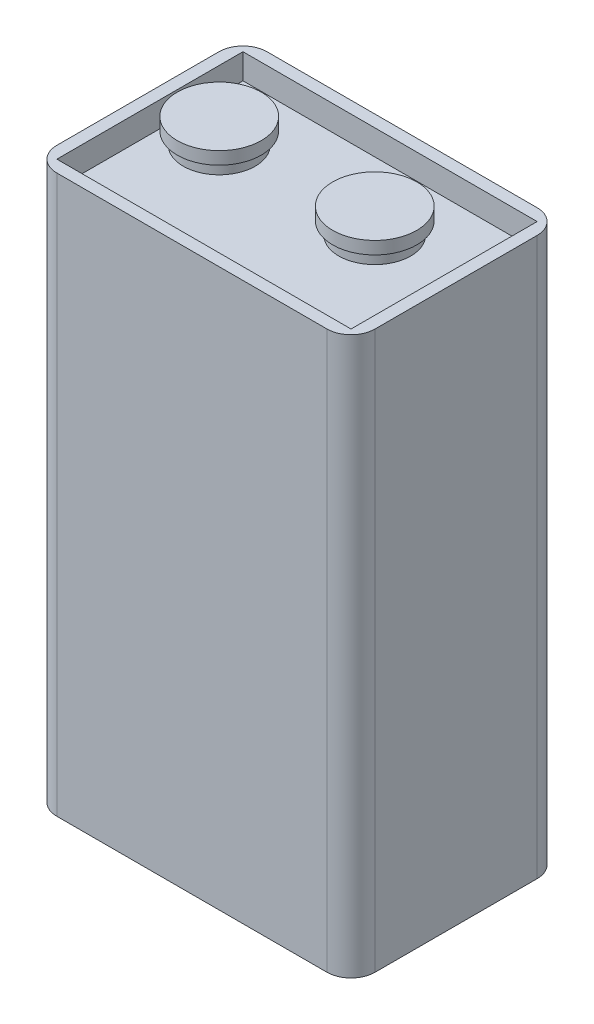
from build123d import *

# Parameters (mm, degrees)
SKETCH2_W           = 26.5
SKETCH2_H           = 17.5
BOSS_EXTRUDE1_DEPTH = 46.4
SKETCH4_R           = 3
BOSS_EXTRUDE5_DEPTH = 1.05
SKETCH5_R           = 3.5
BOSS_EXTRUDE6_DEPTH = 1.05
SKETCH6_R           = 3.5
BOSS_EXTRUDE7_DEPTH = 1.05
SKETCH9_W           = 24.5
SKETCH9_H           = 15.5
CUT_EXTRUDE2_DEPTH  = 2.1
FILLET1_R           = 2
FILLET2_R           = 2
FILLET3_R           = 2
FILLET4_R           = 2


with BuildPart() as part:
    # Sketch2 → Boss-Extrude1 (new body)
    with BuildSketch(Plane(origin=(0, 0, 0), x_dir=(1, 0, 0), z_dir=(0, 1, 0))):
        with Locations((13.25, 8.75)):
            Rectangle(SKETCH2_W, SKETCH2_H)
    extrude(amount=-BOSS_EXTRUDE1_DEPTH)

    # Sketch4 → Boss-Extrude5 (add)
    with BuildSketch(Plane(origin=(0, 0, 0), x_dir=(1, 0, 0), z_dir=(0, 1, 0))):
        with Locations(Location((19.725, 8.75, 0), (0, 0, 90))):
            Circle(SKETCH4_R)
        with Locations(Location((6.775, 8.75, 0), (0, 0, 90))):
            Circle(SKETCH4_R)
    extrude(amount=BOSS_EXTRUDE5_DEPTH)

    # Sketch5 → Boss-Extrude6 (add)
    with BuildSketch(Plane(origin=(0, 1.05, 0), x_dir=(1, 0, 0), z_dir=(0, 1, 0))):
        with Locations(Location((6.775, 8.75, 0), (0, 0, 270))):
            Circle(SKETCH5_R)
    extrude(amount=BOSS_EXTRUDE6_DEPTH)

    # Sketch6 → Boss-Extrude7 (add)
    with BuildSketch(Plane(origin=(0, 1.05, 0), x_dir=(1, 0, 0), z_dir=(0, 1, 0))):
        with Locations(Location((19.725, 8.75, 0), (0, 0, 270))):
            Circle(SKETCH6_R)
    extrude(amount=BOSS_EXTRUDE7_DEPTH)

    # Sketch9 → Cut-Extrude2 (cut)
    with BuildSketch(Plane(origin=(0, 0, 0), x_dir=(1, 0, 0), z_dir=(0, 1, 0))):
        with Locations((13.25, 8.75)):
            Rectangle(SKETCH9_W, SKETCH9_H)
    extrude(amount=-CUT_EXTRUDE2_DEPTH, mode=Mode.SUBTRACT)


with BuildPart() as cut_extrude2_piece_1:
    # of the separate pieces the step leaves, piece 1, a body of its own (cut_extrude2_pieces)
    add(part.part.solids().sort_by_distance((0, 0, 0))[0])

    # Fillet1
    fillet1_edges = [cut_extrude2_piece_1.edges().sort_by_distance(p)[0] for p in [
        (26.5, -23.2, 0),
    ]]
    fillet(fillet1_edges, radius=FILLET1_R)

    # Fillet2
    fillet2_edges = [cut_extrude2_piece_1.edges().sort_by_distance(p)[0] for p in [
        (26.5, -23.2, -17.5),
    ]]
    fillet(fillet2_edges, radius=FILLET2_R)

    # Fillet3
    fillet3_edges = [cut_extrude2_piece_1.edges().sort_by_distance(p)[0] for p in [
        (0, -23.2, -17.5),
    ]]
    fillet(fillet3_edges, radius=FILLET3_R)

    # Fillet4
    fillet4_edges = [cut_extrude2_piece_1.edges().sort_by_distance(p)[0] for p in [
        (0, -23.2, 0),
    ]]
    fillet(fillet4_edges, radius=FILLET4_R)


with BuildPart() as cut_extrude2_piece_2:
    # of the separate pieces the step leaves, piece 2, a body of its own (cut_extrude2_pieces)
    add(part.part.solids().sort_by_distance((6.775, 0, -11.75))[0])


with BuildPart() as cut_extrude2_piece_3:
    # of the separate pieces the step leaves, piece 3, a body of its own (cut_extrude2_pieces)
    add(part.part.solids().sort_by_distance((19.725, 1.05, -5.25))[0])


solid = Compound([cut_extrude2_piece_1.part, cut_extrude2_piece_2.part, cut_extrude2_piece_3.part])
